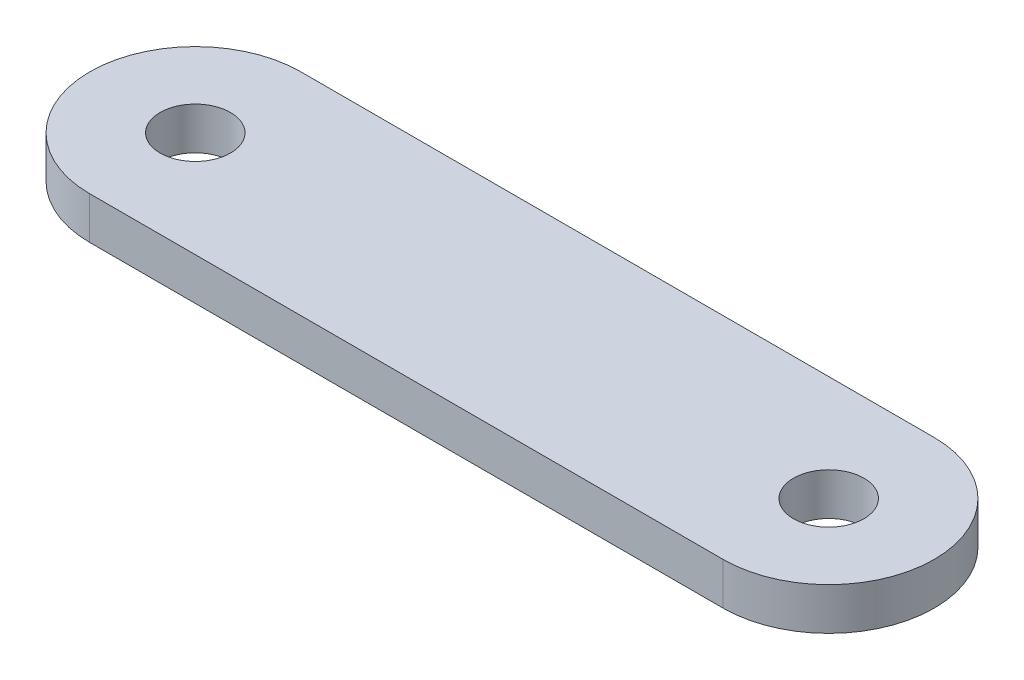
from build123d import *

# Parameters (mm, degrees)
SKETCH2_R           = 5
BOSS_EXTRUDE1_DEPTH = 6


with BuildPart() as part:
    # Sketch2 → Boss-Extrude1 (new body)
    with BuildSketch(Plane(origin=(0, 0, 0), x_dir=(1, 0, 0), z_dir=(0, 1, 0))):
        with BuildLine():
            Line((-45, 15), (45, 15))
            ThreePointArc((45, 15), (60, 0), (45, -15))
            Line((45, -15), (-45, -15))
            ThreePointArc((-45, -15), (-60, 0), (-45, 15))
        make_face()
        with Locations(Location((-45, 0, 0), (0, 0, 270))):
            Circle(SKETCH2_R, mode=Mode.SUBTRACT)
        with Locations(Location((45, 0, 0), (0, 0, 270))):
            Circle(SKETCH2_R, mode=Mode.SUBTRACT)
    extrude(amount=BOSS_EXTRUDE1_DEPTH)


solid = part.part
